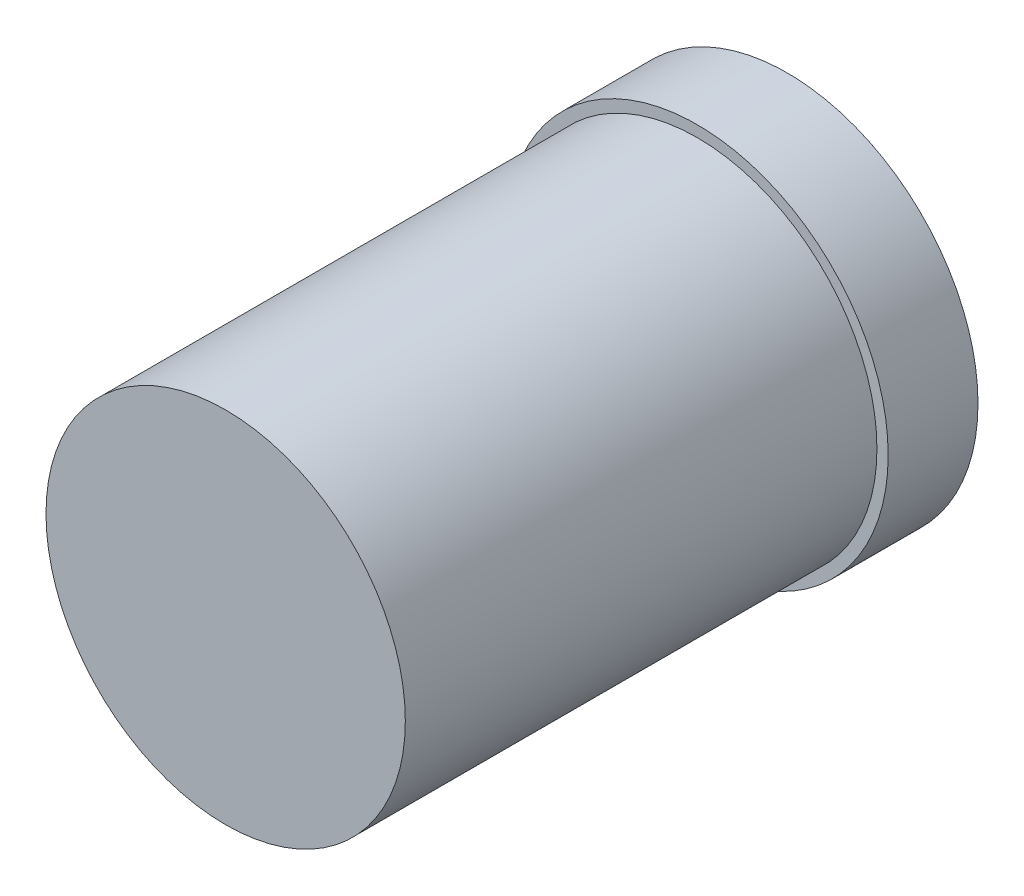
from build123d import *

# Parameters (mm, degrees)
SKETCH1_R           = 85
BOSS_EXTRUDE2_DEPTH = 40
SKETCH3_R           = 80
BOSS_EXTRUDE3_DEPTH = 40
SKETCH4_R           = 80
BOSS_EXTRUDE4_DEPTH = 170


with BuildPart() as part:
    # Sketch1 → Boss-Extrude2 (new body)
    with BuildSketch(Plane.XY):
        Circle(SKETCH1_R)
    extrude(amount=BOSS_EXTRUDE2_DEPTH)

    # Sketch3 → Boss-Extrude3 (add)
    with BuildSketch(Plane.XY.offset(40)):
        Circle(SKETCH3_R)
    extrude(amount=BOSS_EXTRUDE3_DEPTH)

    # Sketch4 → Boss-Extrude4 (add)
    with BuildSketch(Plane.XY.offset(80)):
        Circle(SKETCH4_R)
    extrude(amount=BOSS_EXTRUDE4_DEPTH)


solid = part.part
